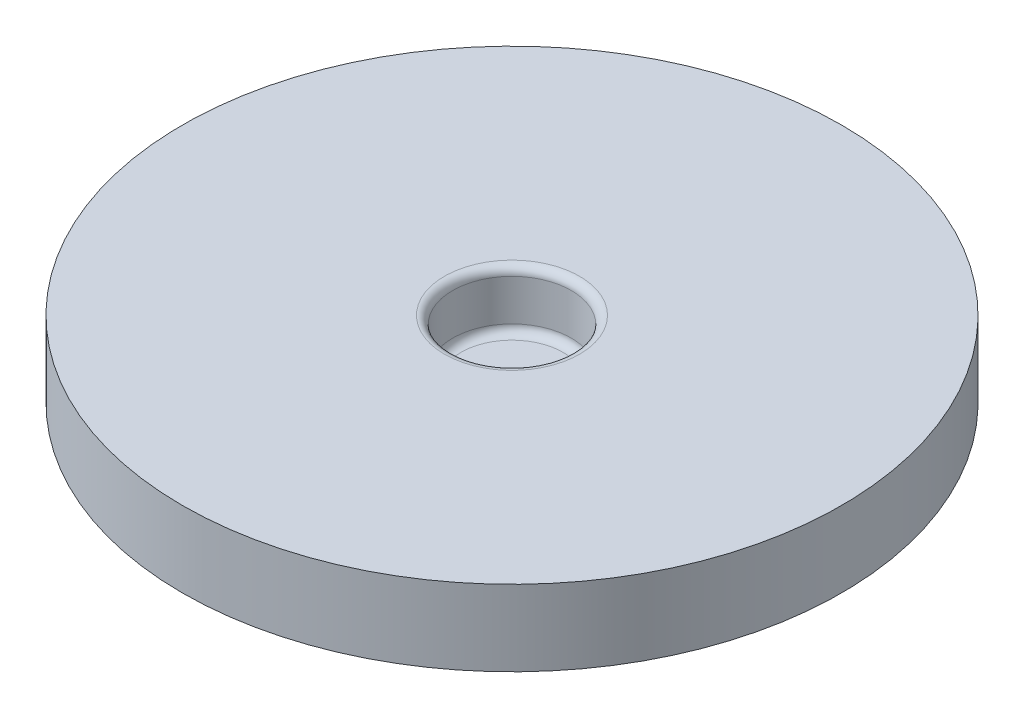
from build123d import *

# Parameters (mm, degrees)
SKETCH_1_R          = 20
EXTRUDE_1_DEPTH     = 4.6
SKETCH_2_R          = 3.6
CUT_EXTRUDE_1_DEPTH = 3.5
FILLET_1_R          = 0.5


with BuildPart() as part:
    # 草图1 → 凸台-拉伸1 (new body)
    with BuildSketch(Plane(origin=(0, 0, 0), x_dir=(1, 0, 0), z_dir=(0, 1, 0))):
        with Locations(Location((0, 0, 0), (0, 0, 270))):
            Circle(SKETCH_1_R)
    extrude(amount=EXTRUDE_1_DEPTH)

    # 草图2 → 切除-拉伸1 (cut)
    with BuildSketch(Plane(origin=(0, 4.6, 0), x_dir=(1, 0, 0), z_dir=(0, 1, 0))):
        with Locations(Location((0, 0, 0), (0, 0, 270))):
            Circle(SKETCH_2_R)
    extrude(amount=-CUT_EXTRUDE_1_DEPTH, mode=Mode.SUBTRACT)

    # 圆角1
    fillet_1_edges = [part.edges().sort_by_distance(p)[0] for p in [
        (0, 1.1, -3.6),
        (0, 4.6, -3.6),
    ]]
    fillet(fillet_1_edges, radius=FILLET_1_R)


solid = part.part
